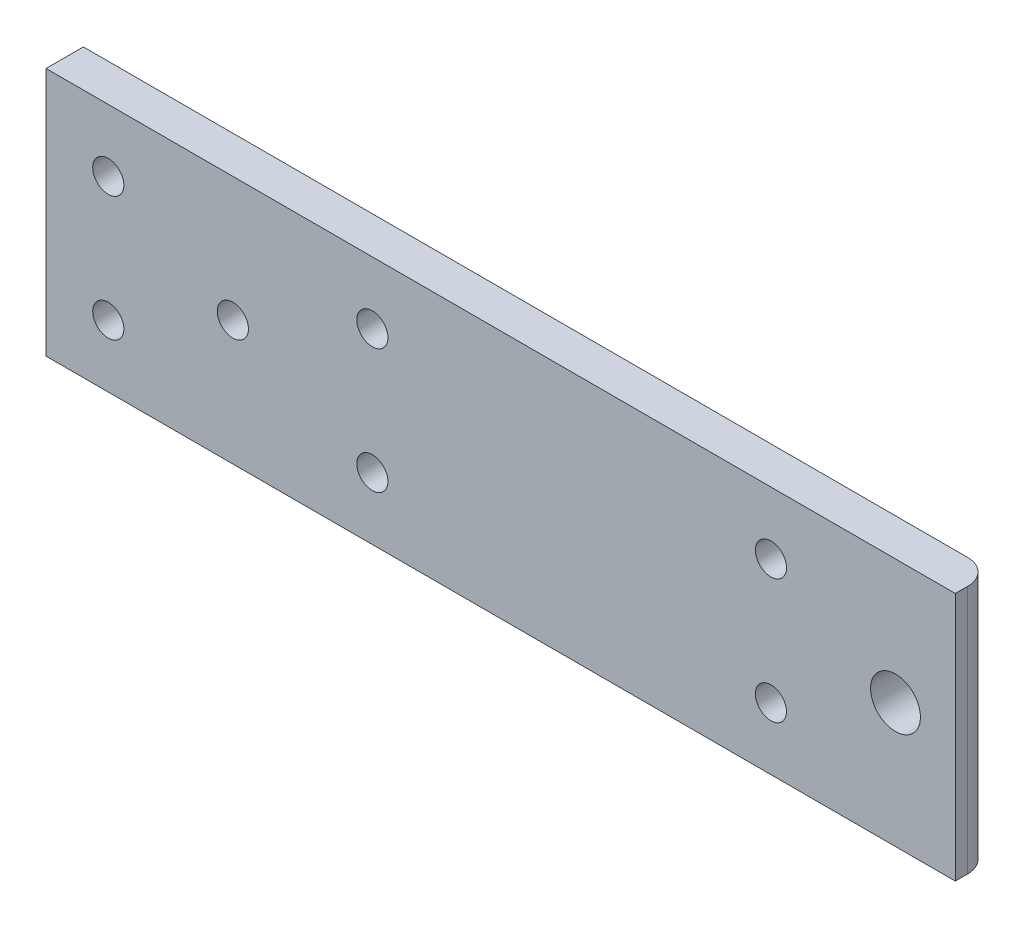
from build123d import *

# Parameters (mm, degrees)
SKETCH_1_W          = 73
SKETCH_1_H          = 3
EXTRUDE_1_DEPTH     = 20
SKETCH_2_R          = 1.25
SKETCH_2_R_2        = 2
CUT_EXTRUDE_1_DEPTH = 20
FILLET_1_R          = 2


with BuildPart() as part:
    # Эскиз1 → Бобышка-Вытянуть1 (new body)
    with BuildSketch(Plane(origin=(0, 0, 0), x_dir=(1, 0, 0), z_dir=(0, 1, 0))):
        with Locations((204.810975887, -13.655372437)):
            Rectangle(SKETCH_1_W, SKETCH_1_H)
    extrude(amount=EXTRUDE_1_DEPTH)

    # Эскиз2 → Вырез-Вытянуть1 (cut)
    with BuildSketch(Plane(origin=(0, 0, 12.155372437), x_dir=(-1, 0, 0), z_dir=(0, 0, -1))):
        with Locations((-173.310975887, 15)):
            Circle(SKETCH_2_R)
        with Locations((-183.310975887, 10)):
            Circle(SKETCH_2_R)
        with Locations((-173.310975887, 5)):
            Circle(SKETCH_2_R)
        with Locations((-236.510975887, 10)):
            Circle(SKETCH_2_R_2)
        with Locations((-194.510975887, 15)):
            Circle(SKETCH_2_R)
        with Locations(Location((-194.510975887, 5, 0), (0, 0, 180))):
            Circle(SKETCH_2_R)
        with Locations((-226.510975887, 15)):
            Circle(SKETCH_2_R)
        with Locations(Location((-226.510975887, 5, 0), (0, 0, 180))):
            Circle(SKETCH_2_R)
    extrude(amount=-CUT_EXTRUDE_1_DEPTH, mode=Mode.SUBTRACT)

    # Скругление1
    fillet_1_edges = [part.edges().sort_by_distance(p)[0] for p in [
        (241.310975887, 10, 12.155372437),
    ]]
    fillet(fillet_1_edges, radius=FILLET_1_R)


solid = part.part
